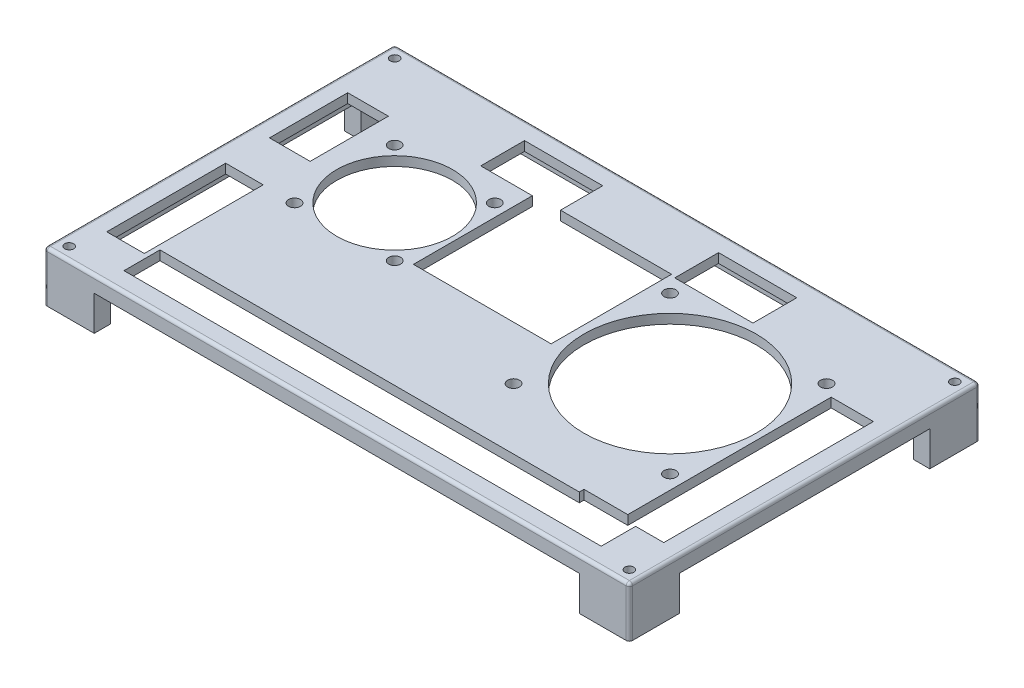
from build123d import *

# Parameters (mm, degrees)
SKETCH1_W                = 187
SKETCH1_H                = 112
SKETCH1_R                = 1.425
SKETCH1_W_2              = 176.5
SKETCH1_H_2              = 101.5
EDGE_2_DEPTH             = 16.1
SKETCH2_W                = 176.5
SKETCH2_H                = 101.5
TOP_COVER_DEPTH          = 3
COMPONENTS_CUTOUTS_REACH = 112.17
SKETCH3_W                = 12
SKETCH3_H                = 38
SKETCH3_W_2              = 13
SKETCH3_H_2              = 25
SKETCH3_W_3              = 25
SKETCH3_H_3              = 14
FAN_HOLES_REACH          = 112.17
SKETCH6_R                = 1.9
SKETCH6_R_2              = 18.5
SKETCH6_R_3              = 27.5
SKETCH4_W                = 155
SKETCH4_H                = 11.1
LENGTH_AIR_VENTS_DEPTH   = 147.783718443
SKETCH5_W                = 80
SKETCH5_H                = 11.1
WIDTH_AIR_VENTS_DEPTH    = 196.867838095
FILLET1_R                = 1


with BuildPart() as part:
    # Sketch1 → Edge 2 (new body)
    with BuildSketch(Plane(origin=(0, 0, 0), x_dir=(1, 0, 0), z_dir=(0, 1, 0))):
        Rectangle(SKETCH1_W, SKETCH1_H)
        with Locations((-89.5, -52)):
            Circle(SKETCH1_R, mode=Mode.SUBTRACT)
        with Locations((89.5, -52)):
            Circle(SKETCH1_R, mode=Mode.SUBTRACT)
        with Locations((89.5, 52)):
            Circle(SKETCH1_R, mode=Mode.SUBTRACT)
        with Locations((-89.5, 52)):
            Circle(SKETCH1_R, mode=Mode.SUBTRACT)
        Rectangle(SKETCH1_W_2, SKETCH1_H_2, mode=Mode.SUBTRACT)
    extrude(amount=EDGE_2_DEPTH)

    # Sketch2 → Top Cover (add)
    with BuildSketch(Plane(origin=(0, 16.1, 0), x_dir=(1, 0, 0), z_dir=(0, 1, 0))):
        Rectangle(SKETCH2_W, SKETCH2_H)
    extrude(amount=-TOP_COVER_DEPTH)

    # Sketch3 → Components Cutouts (cut, up to next)
    with BuildSketch(Plane(origin=(0, 16.1, 0), x_dir=(1, 0, 0), z_dir=(0, 1, 0)), mode=Mode.PRIVATE) as components_cutouts_sk1:
        with Locations((-81.5, -23)):
            Rectangle(SKETCH3_W, SKETCH3_H)
    components_cutouts_tool1 = extrude(components_cutouts_sk1.sketch, amount=-COMPONENTS_CUTOUTS_REACH, mode=Mode.PRIVATE) & part.part
    # Sketch3 → Components Cutouts (cut, up to next)
    with BuildSketch(Plane(origin=(0, 16.1, 0), x_dir=(1, 0, 0), z_dir=(0, 1, 0)), mode=Mode.PRIVATE) as components_cutouts_sk2:
        Polygon((-29.5, 36), (-29.5, -2), (14.5, -2), (14.5, 36.5), (-21, 36.5), (-21, 50), (-46, 50), (-46, 36), align=None)
    components_cutouts_tool2 = extrude(components_cutouts_sk2.sketch, amount=-COMPONENTS_CUTOUTS_REACH, mode=Mode.PRIVATE) & part.part
    # Sketch3 → Components Cutouts (cut, up to next)
    with BuildSketch(Plane(origin=(0, 16.1, 0), x_dir=(1, 0, 0), z_dir=(0, 1, 0)), mode=Mode.PRIVATE) as components_cutouts_sk3:
        with Locations((-81, 22.5)):
            Rectangle(SKETCH3_W_2, SKETCH3_H_2)
    components_cutouts_tool3 = extrude(components_cutouts_sk3.sketch, amount=-COMPONENTS_CUTOUTS_REACH, mode=Mode.PRIVATE) & part.part
    # Sketch3 → Components Cutouts (cut, up to next)
    with BuildSketch(Plane(origin=(0, 16.1, 0), x_dir=(1, 0, 0), z_dir=(0, 1, 0)), mode=Mode.PRIVATE) as components_cutouts_sk4:
        Polygon((60, -38.5), (60, -37), (74, -37), (74, 28), (87.5, 28), (87.5, -39), (78.5, -39), (78.5, -50), (-74, -50), (-74, -38.5), align=None)
    components_cutouts_tool4 = extrude(components_cutouts_sk4.sketch, amount=-COMPONENTS_CUTOUTS_REACH, mode=Mode.PRIVATE) & part.part
    # Sketch3 → Components Cutouts (cut, up to next)
    with BuildSketch(Plane(origin=(0, 16.1, 0), x_dir=(1, 0, 0), z_dir=(0, 1, 0)), mode=Mode.PRIVATE) as components_cutouts_sk5:
        with Locations((28.5, 43)):
            Rectangle(SKETCH3_W_3, SKETCH3_H_3)
    components_cutouts_tool5 = extrude(components_cutouts_sk5.sketch, amount=-COMPONENTS_CUTOUTS_REACH, mode=Mode.PRIVATE) & part.part
    add(components_cutouts_tool1.solids().sort_by_distance((-81.5, 16.1, 23))[0], mode=Mode.SUBTRACT)
    add(components_cutouts_tool2.solids().sort_by_distance((-11.924347, 16.1, -21.628845))[0], mode=Mode.SUBTRACT)
    add(components_cutouts_tool3.solids().sort_by_distance((-81, 16.1, -22.5))[0], mode=Mode.SUBTRACT)
    add(components_cutouts_tool4.solids().sort_by_distance((61.793495, 16.1, 37.75))[0], mode=Mode.SUBTRACT)
    add(components_cutouts_tool5.solids().sort_by_distance((28.5, 16.1, -43))[0], mode=Mode.SUBTRACT)

    # Sketch6 → Fan Holes (cut, up to next)
    with BuildSketch(Plane(origin=(0, 16.1, 0), x_dir=(1, 0, 0), z_dir=(0, 1, 0)), mode=Mode.PRIVATE) as fan_holes_sk1:
        with Locations((-65.5, -4)):
            Circle(SKETCH6_R)
    fan_holes_tool1 = extrude(fan_holes_sk1.sketch, amount=-FAN_HOLES_REACH, mode=Mode.PRIVATE) & part.part
    # Sketch6 → Fan Holes (cut, up to next)
    with BuildSketch(Plane(origin=(0, 16.1, 0), x_dir=(1, 0, 0), z_dir=(0, 1, 0)), mode=Mode.PRIVATE) as fan_holes_sk2:
        with Locations((-65.5, 28)):
            Circle(SKETCH6_R)
    fan_holes_tool2 = extrude(fan_holes_sk2.sketch, amount=-FAN_HOLES_REACH, mode=Mode.PRIVATE) & part.part
    # Sketch6 → Fan Holes (cut, up to next)
    with BuildSketch(Plane(origin=(0, 16.1, 0), x_dir=(1, 0, 0), z_dir=(0, 1, 0)), mode=Mode.PRIVATE) as fan_holes_sk3:
        with Locations((-33.5, 28)):
            Circle(SKETCH6_R)
    fan_holes_tool3 = extrude(fan_holes_sk3.sketch, amount=-FAN_HOLES_REACH, mode=Mode.PRIVATE) & part.part
    # Sketch6 → Fan Holes (cut, up to next)
    with BuildSketch(Plane(origin=(0, 16.1, 0), x_dir=(1, 0, 0), z_dir=(0, 1, 0)), mode=Mode.PRIVATE) as fan_holes_sk4:
        with Locations((-33.5, -4)):
            Circle(SKETCH6_R)
    fan_holes_tool4 = extrude(fan_holes_sk4.sketch, amount=-FAN_HOLES_REACH, mode=Mode.PRIVATE) & part.part
    # Sketch6 → Fan Holes (cut, up to next)
    with BuildSketch(Plane(origin=(0, 16.1, 0), x_dir=(1, 0, 0), z_dir=(0, 1, 0)), mode=Mode.PRIVATE) as fan_holes_sk5:
        with Locations((-49.5, 12)):
            Circle(SKETCH6_R_2)
    fan_holes_tool5 = extrude(fan_holes_sk5.sketch, amount=-FAN_HOLES_REACH, mode=Mode.PRIVATE) & part.part
    # Sketch6 → Fan Holes (cut, up to next)
    with BuildSketch(Plane(origin=(0, 16.1, 0), x_dir=(1, 0, 0), z_dir=(0, 1, 0)), mode=Mode.PRIVATE) as fan_holes_sk6:
        with Locations((44.5, 6)):
            Circle(SKETCH6_R_3)
    fan_holes_tool6 = extrude(fan_holes_sk6.sketch, amount=-FAN_HOLES_REACH, mode=Mode.PRIVATE) & part.part
    # Sketch6 → Fan Holes (cut, up to next)
    with BuildSketch(Plane(origin=(0, 16.1, 0), x_dir=(1, 0, 0), z_dir=(0, 1, 0)), mode=Mode.PRIVATE) as fan_holes_sk7:
        with Locations((19.5, -19)):
            Circle(SKETCH6_R)
    fan_holes_tool7 = extrude(fan_holes_sk7.sketch, amount=-FAN_HOLES_REACH, mode=Mode.PRIVATE) & part.part
    # Sketch6 → Fan Holes (cut, up to next)
    with BuildSketch(Plane(origin=(0, 16.1, 0), x_dir=(1, 0, 0), z_dir=(0, 1, 0)), mode=Mode.PRIVATE) as fan_holes_sk8:
        with Locations((69.5, -19)):
            Circle(SKETCH6_R)
    fan_holes_tool8 = extrude(fan_holes_sk8.sketch, amount=-FAN_HOLES_REACH, mode=Mode.PRIVATE) & part.part
    # Sketch6 → Fan Holes (cut, up to next)
    with BuildSketch(Plane(origin=(0, 16.1, 0), x_dir=(1, 0, 0), z_dir=(0, 1, 0)), mode=Mode.PRIVATE) as fan_holes_sk9:
        with Locations((69.5, 31)):
            Circle(SKETCH6_R)
    fan_holes_tool9 = extrude(fan_holes_sk9.sketch, amount=-FAN_HOLES_REACH, mode=Mode.PRIVATE) & part.part
    # Sketch6 → Fan Holes (cut, up to next)
    with BuildSketch(Plane(origin=(0, 16.1, 0), x_dir=(1, 0, 0), z_dir=(0, 1, 0)), mode=Mode.PRIVATE) as fan_holes_sk10:
        with Locations((19.5, 31)):
            Circle(SKETCH6_R)
    fan_holes_tool10 = extrude(fan_holes_sk10.sketch, amount=-FAN_HOLES_REACH, mode=Mode.PRIVATE) & part.part
    add(fan_holes_tool1.solids().sort_by_distance((-65.5, 16.1, 4))[0], mode=Mode.SUBTRACT)
    add(fan_holes_tool2.solids().sort_by_distance((-65.5, 16.1, -28))[0], mode=Mode.SUBTRACT)
    add(fan_holes_tool3.solids().sort_by_distance((-33.5, 16.1, -28))[0], mode=Mode.SUBTRACT)
    add(fan_holes_tool4.solids().sort_by_distance((-33.5, 16.1, 4))[0], mode=Mode.SUBTRACT)
    add(fan_holes_tool5.solids().sort_by_distance((-49.5, 16.1, -12))[0], mode=Mode.SUBTRACT)
    add(fan_holes_tool6.solids().sort_by_distance((44.5, 16.1, -6))[0], mode=Mode.SUBTRACT)
    add(fan_holes_tool7.solids().sort_by_distance((19.5, 16.1, 19))[0], mode=Mode.SUBTRACT)
    add(fan_holes_tool8.solids().sort_by_distance((69.5, 16.1, 19))[0], mode=Mode.SUBTRACT)
    add(fan_holes_tool9.solids().sort_by_distance((69.5, 16.1, -31))[0], mode=Mode.SUBTRACT)
    add(fan_holes_tool10.solids().sort_by_distance((19.5, 16.1, -31))[0], mode=Mode.SUBTRACT)

    # Sketch4 → Length Air Vents (cut, through all)
    with BuildSketch(Plane.XY.offset(56)):
        with Locations((0, 5.55)):
            Rectangle(SKETCH4_W, SKETCH4_H)
    extrude(amount=-LENGTH_AIR_VENTS_DEPTH, mode=Mode.SUBTRACT)

    # Sketch5 → Width Air Vents (cut, through all)
    with BuildSketch(Plane.ZY.offset(93.5)):
        with Locations((0, 5.55)):
            Rectangle(SKETCH5_W, SKETCH5_H)
    extrude(amount=-WIDTH_AIR_VENTS_DEPTH, mode=Mode.SUBTRACT)

    # Fillet1
    fillet1_edges = [part.edges().sort_by_distance(p)[0] for p in [
        (-93.5, 8.05, -56),
        (93.5, 8.05, -56),
        (93.5, 8.05, 56),
        (93.5, 16.1, 0),
        (0, 16.1, -56),
        (-93.5, 16.1, 0),
        (0, 16.1, 56),
        (-93.5, 8.05, 56),
    ]]
    fillet(fillet1_edges, radius=FILLET1_R)


solid = part.part
